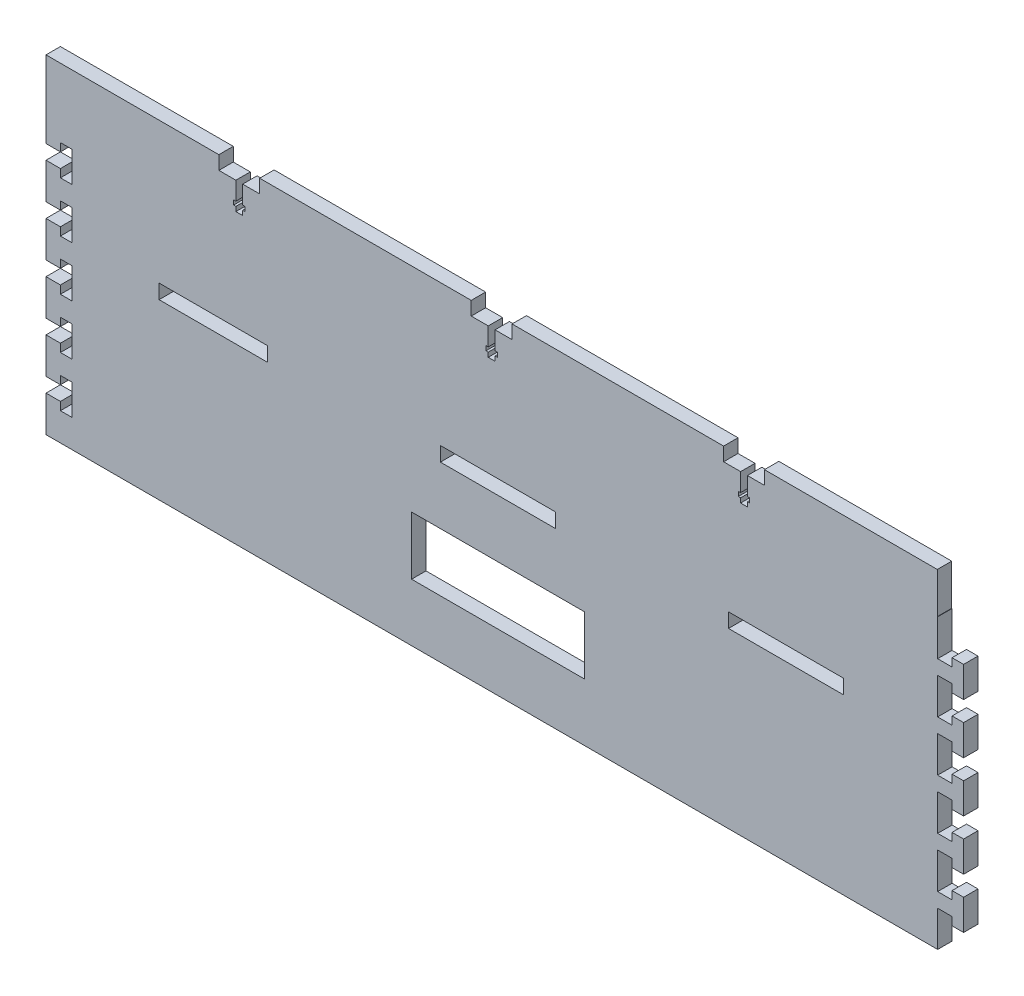
from build123d import *

# Parameters (mm, degrees)
SKETCH1_W             = 393.065
SKETCH1_H             = 127
BOSS_EXTRUDE1_DEPTH   = 6.35
SKETCH2_W             = 76.2
SKETCH2_H             = 25.654
CUT_EXTRUDE1_DEPTH    = 6.35
CUT_EXTRUDE2_DEPTH    = 6.35
LPATTERN1_COUNT       = 5
LPATTERN1_PITCH       = 22.225
BOSS_EXTRUDE2_DEPTH   = 6.35
LPATTERN2_COUNT       = 5
LPATTERN2_PITCH       = 22.225
BOSS_EXTRUDE3_DEPTH   = 6.35
BOSS_EXTRUDE3_2_DEPTH = 6.35
LPATTERN4_COUNT       = 3
LPATTERN4_PITCH       = 111.252
SKETCH14_W            = 50.8
SKETCH14_H            = 6.35
CUT_EXTRUDE3_DEPTH    = 6.35
SKETCH16_W            = 50.8
SKETCH16_H            = 6.35
CUT_EXTRUDE4_DEPTH    = 6.35
SKETCH19_W            = 47.8155
SKETCH19_H            = 6.35
CUT_EXTRUDE5_DEPTH    = 6.35


with BuildPart() as part:
    # Sketch1 → Boss-Extrude1 (new body)
    with BuildSketch(Plane.XY):
        Rectangle(SKETCH1_W, SKETCH1_H)
    extrude(amount=BOSS_EXTRUDE1_DEPTH)

    # Sketch2 → Cut-Extrude1 (cut)
    with BuildSketch(Plane.XY.offset(6.35)):
        with Locations((2.7305, -25.273)):
            Rectangle(SKETCH2_W, SKETCH2_H)
    extrude(amount=-CUT_EXTRUDE1_DEPTH, mode=Mode.SUBTRACT)

    # Sketch3 → Cut-Extrude2 (cut)
    with BuildSketch(Plane.XY.offset(6.35)):
        Polygon((-196.5325, 47.625), (-190.1825, 47.625), (-190.1825, 51.181), (-185.1025, 51.181), (-185.1025, 37.719), (-190.1825, 37.719), (-190.1825, 41.275), (-196.5325, 41.275), align=None)
    cut_extrude2 = extrude(amount=-CUT_EXTRUDE2_DEPTH, mode=Mode.SUBTRACT)

    # LPattern1: Cut-Extrude2 ×5
    with Locations(*[(0, -i * LPATTERN1_PITCH, 0) for i in range(1, LPATTERN1_COUNT)]):
        add(cut_extrude2, mode=Mode.SUBTRACT)


with BuildPart() as body_2:
    # Sketch4 → Boss-Extrude2 (new body)
    with BuildSketch(Plane.XY.offset(6.35)):
        Polygon((196.5325, 47.498), (202.8825, 47.498), (202.8825, 51.054), (207.9625, 51.054), (207.9625, 37.592), (202.8825, 37.592), (202.8825, 41.148), (196.5325, 41.148), align=None)
    boss_extrude2 = extrude(amount=-BOSS_EXTRUDE2_DEPTH)


with BuildPart() as lpattern2_1:
    # LPattern2: pattern copy
    add(boss_extrude2.moved(Location(Vector(0, -1, 0) * (1 * LPATTERN2_PITCH))))


with BuildPart() as lpattern2_2:
    # LPattern2: pattern copy
    add(boss_extrude2.moved(Location(Vector(0, -1, 0) * (2 * LPATTERN2_PITCH))))


with BuildPart() as lpattern2_3:
    # LPattern2: pattern copy
    add(boss_extrude2.moved(Location(Vector(0, -1, 0) * (3 * LPATTERN2_PITCH))))


with BuildPart() as lpattern2_4:
    # LPattern2: pattern copy
    add(boss_extrude2.moved(Location(Vector(0, -1, 0) * (4 * LPATTERN2_PITCH))))


with BuildPart() as body_2_1:
    add(body_2.part)

    # Combine1: union part, LPattern2_1, LPattern2_2, LPattern2_3, LPattern2_4
    add(part.part)
    add(lpattern2_1.part)
    add(lpattern2_2.part)
    add(lpattern2_3.part)
    add(lpattern2_4.part)


with BuildPart() as body_2_2:
    # Sketch12 → Boss-Extrude3 (new body)
    with BuildSketch(Plane.XY.offset(6.35)):
        Polygon((-196.5325, 81.5), (-196.5325, 63.5), (-112.832500014, 63.5), (-112.832500014, 65.5), (-113.832500014, 65.5), (-113.832500014, 67.5), (-112.832500014, 67.5), (-112.832500014, 75.5), (-120.3325, 75.5), (-120.3325, 81.5), align=None)
    boss_extrude3 = extrude(amount=-BOSS_EXTRUDE3_DEPTH)


with BuildPart() as body_3:
    # Sketch12 → Boss-Extrude3 2 (new body)
    with BuildSketch(Plane.XY.offset(6.35)):
        Polygon((-109.832500014, 65.5), (-109.832500014, 63.5), (-26.132500014, 63.5), (-26.132500014, 81.5), (-102.332500014, 81.5), (-102.332500014, 75.5), (-109.832500014, 75.5), (-109.832500014, 67.5), (-108.832500014, 67.5), (-108.832500014, 65.5), align=None)
    boss_extrude3_2 = extrude(amount=-BOSS_EXTRUDE3_2_DEPTH)


with BuildPart() as lpattern4_1:
    # LPattern4: pattern copy
    add(boss_extrude3.moved(Location(Vector(1, 0, 0) * (1 * LPATTERN4_PITCH))))


with BuildPart() as lpattern4_2:
    # LPattern4: pattern copy
    add(boss_extrude3.moved(Location(Vector(1, 0, 0) * (2 * LPATTERN4_PITCH))))


with BuildPart() as lpattern4_3:
    # LPattern4: pattern copy
    add(boss_extrude3_2.moved(Location(Vector(1, 0, 0) * (1 * LPATTERN4_PITCH))))


with BuildPart() as lpattern4_4:
    # LPattern4: pattern copy
    add(boss_extrude3_2.moved(Location(Vector(1, 0, 0) * (2 * LPATTERN4_PITCH))))


with BuildPart() as body_2_2_1:
    add(body_2_2.part)

    # Combine2: union body 3, LPattern4_3, LPattern4_1, LPattern4_2, LPattern4_4, body 2
    add(body_3.part)
    add(lpattern4_3.part)
    add(lpattern4_1.part)
    add(lpattern4_2.part)
    add(lpattern4_4.part)
    add(body_2_1.part)

    # Sketch14 → Cut-Extrude3 (cut)
    with BuildSketch(Plane.XY.offset(6.35)):
        with Locations((2.7305, 16.129)):
            Rectangle(SKETCH14_W, SKETCH14_H)
    extrude(amount=-CUT_EXTRUDE3_DEPTH, mode=Mode.SUBTRACT)

    # Sketch16 → Cut-Extrude4 (cut)
    with BuildSketch(Plane.XY.offset(6.35)):
        with Locations((129.7305, 16.129)):
            Rectangle(SKETCH16_W, SKETCH16_H)
    extrude(amount=-CUT_EXTRUDE4_DEPTH, mode=Mode.SUBTRACT)

    # Sketch19 → Cut-Extrude5 (cut)
    with BuildSketch(Plane.XY.offset(6.35)):
        with Locations((-122.77725, 16.129)):
            Rectangle(SKETCH19_W, SKETCH19_H)
    extrude(amount=-CUT_EXTRUDE5_DEPTH, mode=Mode.SUBTRACT)


solid = body_2_2_1.part
